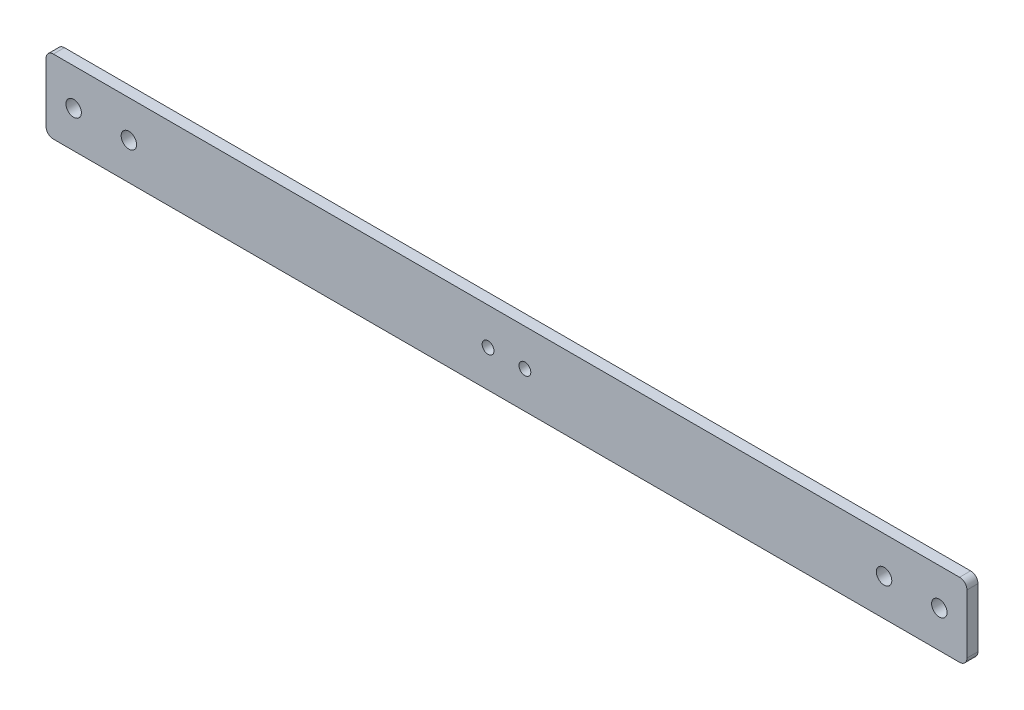
from build123d import *

# Parameters (mm, degrees)
SKETCH_1_W          = 250
SKETCH_1_H          = 20
EXTRUDE_1_DEPTH     = 3
SKETCH_2_R          = 2.1
SKETCH_2_R_2        = 1.6
CUT_EXTRUDE_1_DEPTH = 3
FILLET_1_R          = 2


with BuildPart() as part:
    # 草图1 → 凸台-拉伸1 (new body)
    with BuildSketch(Plane.XY):
        Rectangle(SKETCH_1_W, SKETCH_1_H)
    extrude(amount=EXTRUDE_1_DEPTH)

    # 草图2 → 切除-拉伸1 (cut)
    with BuildSketch(Plane.XY.offset(3)):
        with Locations((-117.5, 0)):
            Circle(SKETCH_2_R)
        with Locations((-102.5, 0)):
            Circle(SKETCH_2_R)
        with Locations(Location((102.5, 0, 0), (0, 0, 180))):
            Circle(SKETCH_2_R)
        with Locations(Location((117.5, 0, 0), (0, 0, 180))):
            Circle(SKETCH_2_R)
        with Locations((-5, 0)):
            Circle(SKETCH_2_R_2)
        with Locations(Location((5, 0, 0), (0, 0, 180))):
            Circle(SKETCH_2_R_2)
    extrude(amount=-CUT_EXTRUDE_1_DEPTH, mode=Mode.SUBTRACT)

    # 圆角1
    fillet_1_edges = [part.edges().sort_by_distance(p)[0] for p in [
        (125, -10, 1.5),
        (-125, -10, 1.5),
        (-125, 10, 1.5),
        (125, 10, 1.5),
    ]]
    fillet(fillet_1_edges, radius=FILLET_1_R)


solid = part.part
